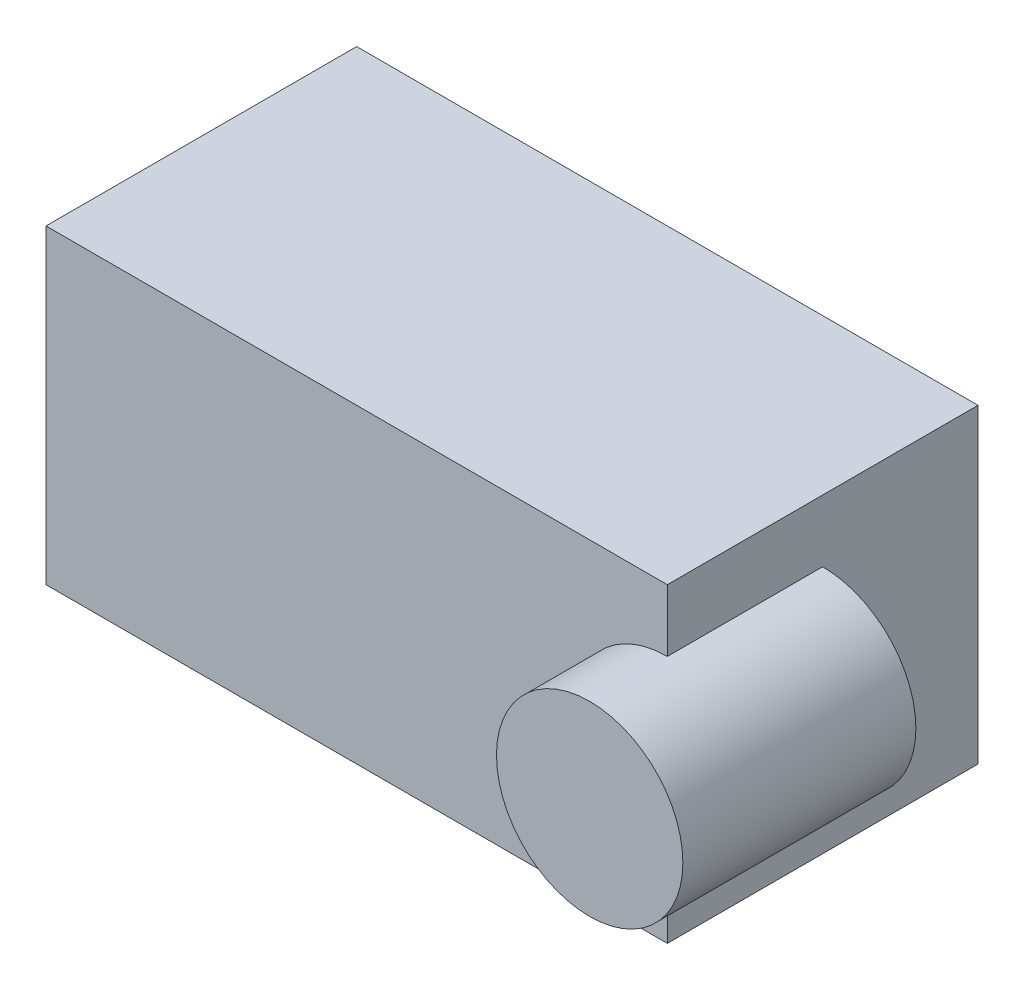
from build123d import *

# Parameters (mm, degrees)
SKETCH1_W           = 40
SKETCH1_H           = 20
BOSS_EXTRUDE1_DEPTH = 10
SKETCH2_R           = 6
BOSS_EXTRUDE2_DEPTH = 15


with BuildPart() as part:
    # Sketch1 → Boss-Extrude1 (new, symmetric)
    with BuildSketch(Plane.XY):
        with Locations((20, 10)):
            Rectangle(SKETCH1_W, SKETCH1_H)
    extrude(amount=BOSS_EXTRUDE1_DEPTH, both=True)

    # Sketch2 → Boss-Extrude2 (add)
    with BuildSketch(Plane.XY):
        with Locations((40, 10)):
            Circle(SKETCH2_R)
    extrude(amount=BOSS_EXTRUDE2_DEPTH)


solid = part.part
